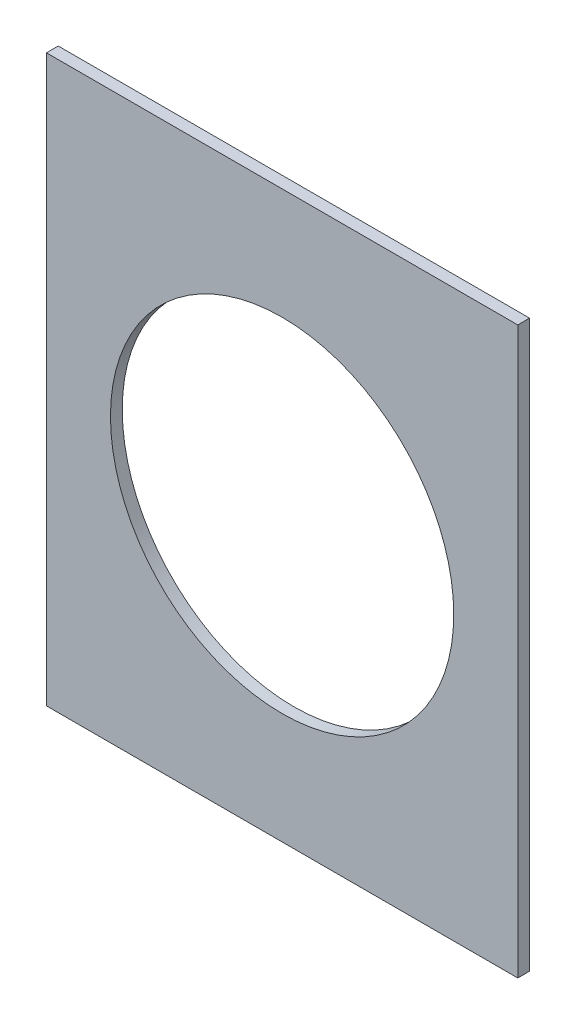
from build123d import *

# Parameters (mm, degrees)
ESQUISSE1_W             = 600
ESQUISSE1_H             = 720
BOSS_EXTRU_1_DEPTH      = 15
ESQUISSE2_R             = 218.5
ENL_V_MAT_EXTRU_1_DEPTH = 15


with BuildPart() as part:
    # Esquisse1 → Boss.-Extru.1 (new body)
    with BuildSketch(Plane.XY):
        Rectangle(ESQUISSE1_W, ESQUISSE1_H)
    extrude(amount=BOSS_EXTRU_1_DEPTH)

    # Esquisse2 → Enlèv. mat.-Extru.1 (cut)
    with BuildSketch(Plane.XY.offset(15)):
        Circle(ESQUISSE2_R)
    extrude(amount=-ENL_V_MAT_EXTRU_1_DEPTH, mode=Mode.SUBTRACT)


solid = part.part
